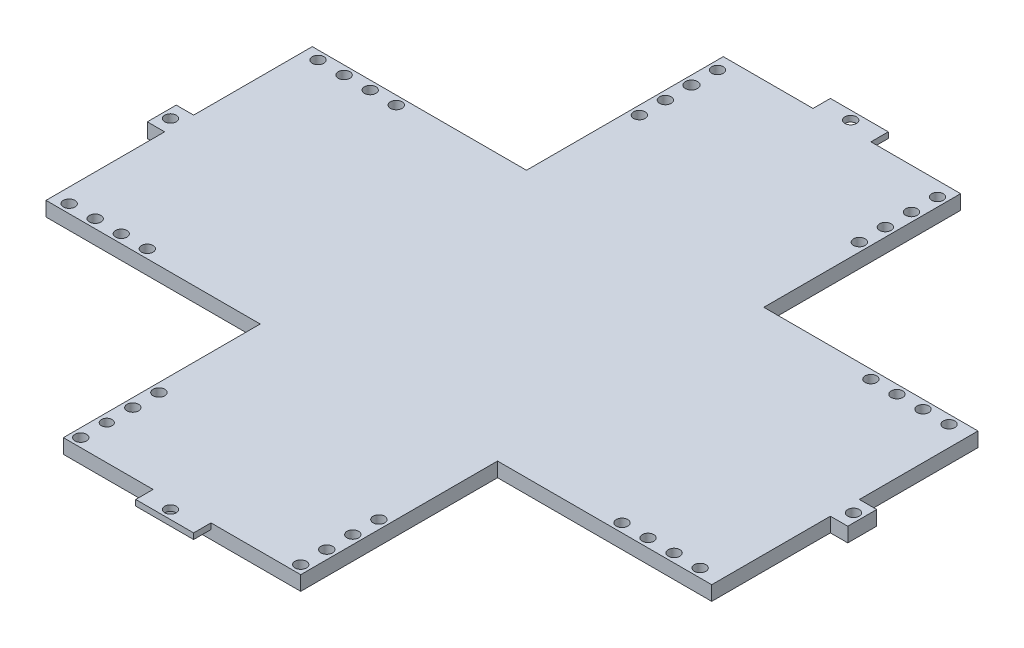
from build123d import *

# Parameters (mm, degrees)
BOSS_EXTRUDE1_DEPTH = 12.7
SKETCH3_W           = 78.74
SKETCH3_H           = 15.24
CUT_EXTRUDE1_DEPTH  = 15.24
SKETCH5_W           = 50.8
SKETCH5_H           = 15.24
CUT_EXTRUDE2_DEPTH  = 7.62
SKETCH6_R           = 5.08
CUT_EXTRUDE3_DEPTH  = 10.16
SKETCH7_W           = 15.24
SKETCH7_H           = 104.14
CUT_EXTRUDE4_DEPTH  = 15.24
SKETCH8_R           = 5.08
CUT_EXTRUDE5_DEPTH  = 15.24
SKETCH9_R           = 5.08
SKETCH9_R_2         = 5.375081868
SKETCH9_R_3         = 4.728276711
CUT_EXTRUDE6_DEPTH  = 15.24


with BuildPart() as part:
    # Sketch1 → Boss-Extrude1 (new body)
    with BuildSketch(Plane(origin=(0, 0, 0), x_dir=(1, 0, 0), z_dir=(0, 1, 0))):
        Polygon((0, 0), (0, 233.68), (203.2, 233.68), (203.2, 421.64), (411.48, 421.64), (411.48, 233.68), (614.68, 233.68), (614.68, 0), (411.48, 0), (411.48, -187.96), (203.2, -187.96), (203.2, 0), align=None)
    extrude(amount=BOSS_EXTRUDE1_DEPTH)

    # Sketch3 → Cut-Extrude1 (cut)
    with BuildSketch(Plane(origin=(0, 12.7, 0), x_dir=(1, 0, 0), z_dir=(0, 1, 0))):
        with Locations((242.57, 414.02)):
            Rectangle(SKETCH3_W, SKETCH3_H)
        with Locations((372.11, 414.02)):
            Rectangle(SKETCH3_W, SKETCH3_H)
        with Locations((372.11, -180.34)):
            Rectangle(SKETCH3_W, SKETCH3_H)
        with Locations((242.57, -180.34)):
            Rectangle(SKETCH3_W, SKETCH3_H)
    extrude(amount=-CUT_EXTRUDE1_DEPTH, mode=Mode.SUBTRACT)

    # Sketch5 → Cut-Extrude2 (cut)
    with BuildSketch(Plane(origin=(0, 0, 0), x_dir=(-1, 0, 0), z_dir=(0, -1, 0))):
        with Locations((-307.34, -180.34)):
            Rectangle(SKETCH5_W, SKETCH5_H)
        with Locations((-307.34, 414.02)):
            Rectangle(SKETCH5_W, SKETCH5_H)
    extrude(amount=-CUT_EXTRUDE2_DEPTH, mode=Mode.SUBTRACT)

    # Sketch6 → Cut-Extrude3 (cut)
    with BuildSketch(Plane(origin=(0, 12.7, 0), x_dir=(1, 0, 0), z_dir=(0, 1, 0))):
        with Locations(Location((307.34, 414.02, 0), (0, 0, 270))):
            Circle(SKETCH6_R)
        with Locations(Location((304.8, -180.34, 0), (0, 0, 270))):
            Circle(SKETCH6_R)
    extrude(amount=-CUT_EXTRUDE3_DEPTH, mode=Mode.SUBTRACT)

    # Sketch7 → Cut-Extrude4 (cut)
    with BuildSketch(Plane(origin=(0, 12.7, 0), x_dir=(1, 0, 0), z_dir=(0, 1, 0))):
        with Locations((7.62, 52.07)):
            Rectangle(SKETCH7_W, SKETCH7_H)
        with Locations((7.62, 181.61)):
            Rectangle(SKETCH7_W, SKETCH7_H)
        with Locations((607.06, 52.07)):
            Rectangle(SKETCH7_W, SKETCH7_H)
        with Locations((607.06, 181.61)):
            Rectangle(SKETCH7_W, SKETCH7_H)
    extrude(amount=-CUT_EXTRUDE4_DEPTH, mode=Mode.SUBTRACT)

    # Sketch8 → Cut-Extrude5 (cut)
    with BuildSketch(Plane(origin=(0, 12.7, 0), x_dir=(1, 0, 0), z_dir=(0, 1, 0))):
        with Locations(Location((607.06, 116.84, 0), (0, 0, 270))):
            Circle(SKETCH8_R)
        with Locations(Location((7.62, 116.84, 0), (0, 0, 270))):
            Circle(SKETCH8_R)
    extrude(amount=-CUT_EXTRUDE5_DEPTH, mode=Mode.SUBTRACT)

    # Sketch9 → Cut-Extrude6 (cut)
    with BuildSketch(Plane(origin=(0, 12.7, 0), x_dir=(1, 0, 0), z_dir=(0, 1, 0))):
        with Locations(Location((27.94, 226.06, 0), (0, 0, 270))):
            Circle(SKETCH9_R)
        with Locations(Location((50.8, 226.06, 0), (0, 0, 270))):
            Circle(SKETCH9_R)
        with Locations(Location((73.66, 226.06, 0), (0, 0, 270))):
            Circle(SKETCH9_R)
        with Locations(Location((96.52, 226.06, 0), (0, 0, 270))):
            Circle(SKETCH9_R)
        with Locations(Location((581.66, 226.06, 0), (0, 0, 270))):
            Circle(SKETCH9_R)
        with Locations(Location((558.8, 226.06, 0), (0, 0, 270))):
            Circle(SKETCH9_R)
        with Locations(Location((535.94, 226.06, 0), (0, 0, 270))):
            Circle(SKETCH9_R)
        with Locations(Location((513.08, 226.06, 0), (0, 0, 270))):
            Circle(SKETCH9_R)
        with Locations(Location((27.94, 7.62, 0), (0, 0, 270))):
            Circle(SKETCH9_R)
        with Locations(Location((50.8, 7.62, 0), (0, 0, 270))):
            Circle(SKETCH9_R)
        with Locations(Location((73.66, 7.62, 0), (0, 0, 270))):
            Circle(SKETCH9_R)
        with Locations(Location((96.52, 7.62, 0), (0, 0, 270))):
            Circle(SKETCH9_R)
        with Locations(Location((581.66, 7.62, 0), (0, 0, 270))):
            Circle(SKETCH9_R)
        with Locations(Location((558.8, 7.62, 0), (0, 0, 270))):
            Circle(SKETCH9_R)
        with Locations(Location((535.94, 7.62, 0), (0, 0, 270))):
            Circle(SKETCH9_R)
        with Locations(Location((513.08, 7.62, 0), (0, 0, 270))):
            Circle(SKETCH9_R)
        with Locations(Location((210.82, 393.7, 0), (0, 0, 270))):
            Circle(SKETCH9_R)
        with Locations(Location((403.86, 393.7, 0), (0, 0, 270))):
            Circle(SKETCH9_R)
        with Locations(Location((210.82, 370.84, 0), (0, 0, 270))):
            Circle(SKETCH9_R_2)
        with Locations(Location((210.82, 347.98, 0), (0, 0, 270))):
            Circle(SKETCH9_R)
        with Locations(Location((210.82, 325.12, 0), (0, 0, 270))):
            Circle(SKETCH9_R)
        with Locations(Location((403.86, 370.84, 0), (0, 0, 270))):
            Circle(SKETCH9_R)
        with Locations(Location((403.86, 347.98, 0), (0, 0, 270))):
            Circle(SKETCH9_R)
        with Locations(Location((403.86, 325.12, 0), (0, 0, 270))):
            Circle(SKETCH9_R)
        with Locations(Location((210.82, -165.1, 0), (0, 0, 270))):
            Circle(SKETCH9_R)
        with Locations(Location((403.86, -165.1, 0), (0, 0, 270))):
            Circle(SKETCH9_R)
        with Locations(Location((210.82, -142.24, 0), (0, 0, 270))):
            Circle(SKETCH9_R_3)
        with Locations(Location((210.82, -119.38, 0), (0, 0, 270))):
            Circle(SKETCH9_R)
        with Locations(Location((210.82, -96.52, 0), (0, 0, 270))):
            Circle(SKETCH9_R)
        with Locations(Location((403.86, -142.24, 0), (0, 0, 270))):
            Circle(SKETCH9_R)
        with Locations(Location((403.86, -119.38, 0), (0, 0, 270))):
            Circle(SKETCH9_R)
        with Locations(Location((403.86, -96.52, 0), (0, 0, 270))):
            Circle(SKETCH9_R)
    extrude(amount=-CUT_EXTRUDE6_DEPTH, mode=Mode.SUBTRACT)


solid = part.part
